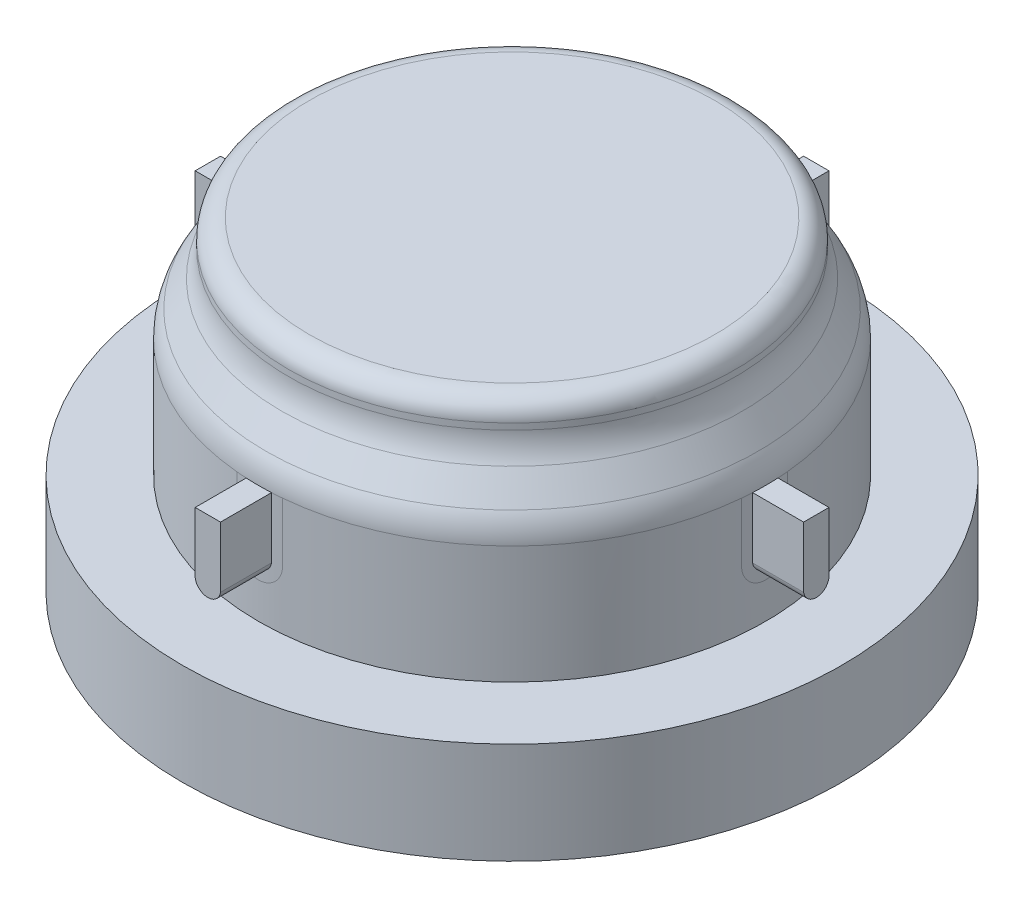
from build123d import *
from OCP.BRepFilletAPI import BRepFilletAPI_MakeFillet

# Parameters (mm, degrees)
SKETCH1_R           = 32.5
BOSS_EXTRUDE1_DEPTH = 10
FILLET1_R1          = 5
FILLET1_R2          = 2
BOSS_EXTRUDE2_DEPTH = 30
CIRPATTERN1_COUNT   = 4


with BuildPart() as part:
    # Sketch1 → Boss-Extrude1 (new body)
    with BuildSketch(Plane(origin=(0, 0, 0), x_dir=(1, 0, 0), z_dir=(0, 1, 0))):
        with Locations(Location((0, 0, 0), (0, 0, 270))):
            Circle(SKETCH1_R)
    boss_extrude1 = extrude(amount=-BOSS_EXTRUDE1_DEPTH)

    # Sketch2 → Revolve1 (revolve)
    with BuildSketch(Plane(origin=(0, 0, 0), x_dir=(0, 0, -1), z_dir=(1, 0, 0))):
        Polygon((0, 0), (0, 22), (22, 22), (22, 18), (25, 13), (25, 0), align=None)
    revolve(axis=Axis((0, 0, 0), (0, 1, 0)))

    # Fillet1: one fillet with a radius per group of edges: ONE call of the kernel's fillet builder (fillet() takes one radius for all edges)
    fillet1_edges_1 = [part.edges().sort_by_distance(p)[0] for p in [
        (0, 18, 22),
        (0, 13, 25),
    ]]
    fillet1_edges_2 = [part.edges().sort_by_distance(p)[0] for p in [
        (0, 22, 22),
    ]]
    fillet1 = BRepFilletAPI_MakeFillet(part.part.solid().wrapped)
    for e in fillet1_edges_1:
        fillet1.Add(FILLET1_R1, e.wrapped)
    for e in fillet1_edges_2:
        fillet1.Add(FILLET1_R2, e.wrapped)
    add(Compound.cast(fillet1.Shape()), mode=Mode.REPLACE)

    # Sketch3 → Boss-Extrude2 (add)
    with BuildSketch(Plane(origin=(0, 0, 0), x_dir=(0, 0, -1), z_dir=(1, 0, 0))):
        with BuildLine():
            Line((1.25, 11.615080175), (-1.25, 11.615080175))
            Line((-1.25, 11.615080175), (-1.25, 5.615080175))
            ThreePointArc((-1.25, 5.615080175), (0, 4.544871187), (1.25, 5.615080175))
            Line((1.25, 5.615080175), (1.25, 11.615080175))
        make_face()
    boss_extrude2 = extrude(amount=BOSS_EXTRUDE2_DEPTH)

    # CirPattern1: Boss-Extrude1, Boss-Extrude2 ×4 about axis
    cirpattern1_axis = Axis((0, 0, 0), (0, 1, 0))
    add([boss_extrude1.rotate(cirpattern1_axis, i * 360 / CIRPATTERN1_COUNT) for i in range(1, CIRPATTERN1_COUNT)])
    add([boss_extrude2.rotate(cirpattern1_axis, i * 360 / CIRPATTERN1_COUNT) for i in range(1, CIRPATTERN1_COUNT)])


solid = part.part
